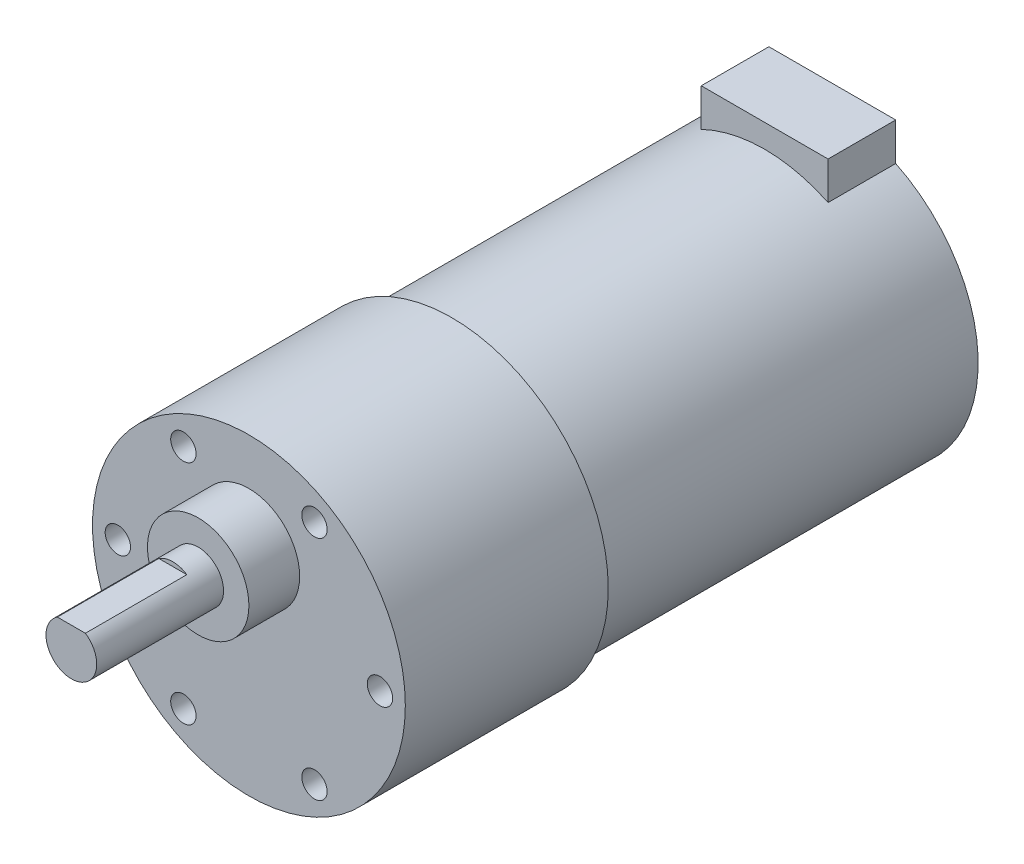
from build123d import *

# Parameters (mm, degrees)
SKETCH1_R           = 18.5
BOSS_EXTRUDE1_DEPTH = 24
SKETCH2_R           = 17.25
BOSS_EXTRUDE2_DEPTH = 45
SKETCH3_R           = 6
BOSS_EXTRUDE3_DEPTH = 6
SKETCH4_R           = 3
BOSS_EXTRUDE4_DEPTH = 15
CUT_EXTRUDE1_START  = -12
CUT_EXTRUDE1_DEPTH  = 12
SKETCH6_R           = 1.5
CUT_EXTRUDE2_DEPTH  = 3
SKETCH7_W           = 15
SKETCH7_H           = 8
BOSS_EXTRUDE5_DEPTH = 20


with BuildPart() as part:
    # Sketch1 → Boss-Extrude1 (new body)
    with BuildSketch(Plane.XY):
        Circle(SKETCH1_R)
    extrude(amount=BOSS_EXTRUDE1_DEPTH)

    # Sketch2 → Boss-Extrude2 (add)
    with BuildSketch(Plane(origin=(0, 0, 0), x_dir=(-1, 0, 0), z_dir=(0, 0, -1))):
        with Locations(Location((0, 0, 0), (0, 0, 180))):
            Circle(SKETCH2_R)
    extrude(amount=BOSS_EXTRUDE2_DEPTH)

    # Sketch3 → Boss-Extrude3 (add)
    with BuildSketch(Plane.XY.offset(24)):
        with Locations((0, 7)):
            Circle(SKETCH3_R)
    extrude(amount=BOSS_EXTRUDE3_DEPTH)

    # Sketch4 → Boss-Extrude4 (add)
    with BuildSketch(Plane.XY.offset(30)):
        with Locations((0, 7)):
            Circle(SKETCH4_R)
    extrude(amount=BOSS_EXTRUDE4_DEPTH)

    # Sketch5 → Cut-Extrude1 (cut)
    with BuildSketch(Plane.XY.offset(45).offset(CUT_EXTRUDE1_START)):
        with BuildLine():
            ThreePointArc((1.658312395, 9.5), (0, 10), (-1.658312395, 9.5))
            Line((-1.658312395, 9.5), (0, 9.5))
            Line((0, 9.5), (1.658312395, 9.5))
        make_face()
    extrude(amount=CUT_EXTRUDE1_DEPTH, mode=Mode.SUBTRACT)

    # Sketch6 → Cut-Extrude2 (cut)
    with BuildSketch(Plane.XY.offset(24)):
        with Locations((7.75, 13.423393759)):
            Circle(SKETCH6_R)
        with Locations((15.5, 0)):
            Circle(SKETCH6_R)
        with Locations((7.75, -13.423393759)):
            Circle(SKETCH6_R)
        with Locations((-7.75, -13.423393759)):
            Circle(SKETCH6_R)
        with Locations((-15.5, 0)):
            Circle(SKETCH6_R)
        with Locations((-7.75, 13.423393759)):
            Circle(SKETCH6_R)
    extrude(amount=-CUT_EXTRUDE2_DEPTH, mode=Mode.SUBTRACT)

    # Sketch7 → Boss-Extrude5 (add)
    with BuildSketch(Plane(origin=(0, 0, 0), x_dir=(1, 0, 0), z_dir=(0, 1, 0))):
        with Locations((0, 41)):
            Rectangle(SKETCH7_W, SKETCH7_H)
    extrude(amount=BOSS_EXTRUDE5_DEPTH)


solid = part.part
